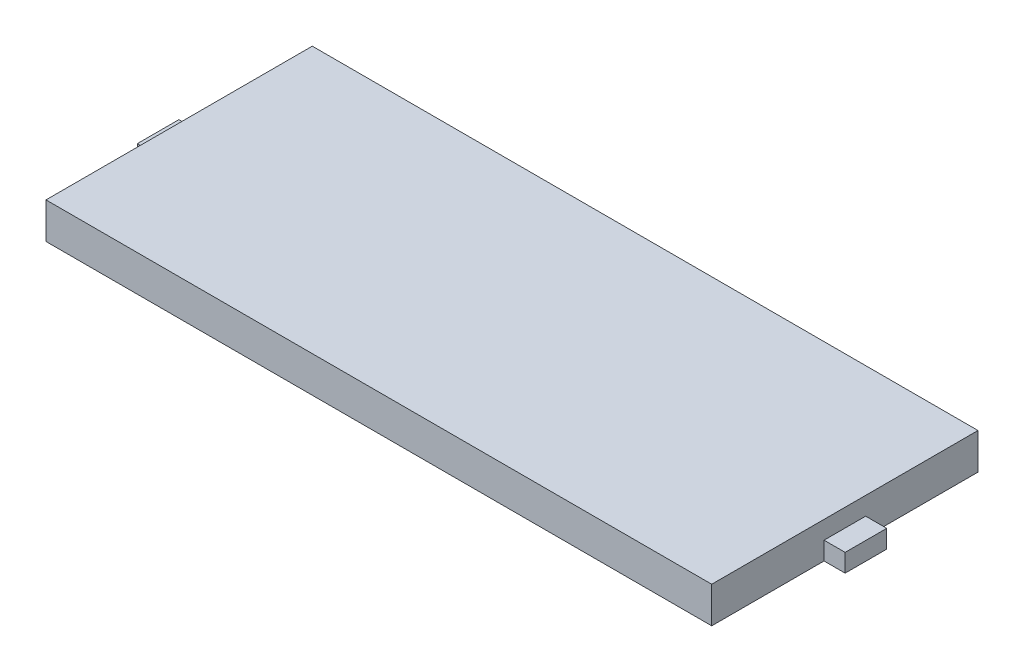
from build123d import *

# Parameters (mm, degrees)
SKETCH1_W           = 12
SKETCH1_H           = 4.8
BOSS_EXTRUDE1_DEPTH = 0.65
SKETCH2_W           = 5.76
SKETCH2_H           = 0.75
BOSS_EXTRUDE2_DEPTH = 0.325
SKETCH2_2_W         = 5.76
SKETCH2_2_H         = 0.75
CUT_EXTRUDE1_DEPTH  = 0.325


with BuildPart() as part:
    # Sketch1 → Boss-Extrude1 (new body)
    with BuildSketch(Plane(origin=(0, 0, 0), x_dir=(1, 0, 0), z_dir=(0, 1, 0))):
        Rectangle(SKETCH1_W, SKETCH1_H)
    extrude(amount=BOSS_EXTRUDE1_DEPTH)

    # Sketch2<2> → Cut-Extrude1 (cut)
    with BuildSketch(Plane(origin=(0, 0, 0), x_dir=(-1, 0, 0), z_dir=(0, 1, 0))):
        with Locations((3.5, 0)):
            Rectangle(SKETCH2_2_W, SKETCH2_2_H)
    cut_extrude1 = extrude(amount=CUT_EXTRUDE1_DEPTH, mode=Mode.SUBTRACT)

    # Mirror2: Cut-Extrude1 across plane
    add(cut_extrude1.mirror(Plane(origin=(0, 0, 0), x_dir=(0, 0, 1), z_dir=(1, 0, 0))), mode=Mode.SUBTRACT)


with BuildPart() as body_2:
    # Sketch2 → Boss-Extrude2 (new body)
    with BuildSketch(Plane(origin=(0, 0, 0), x_dir=(-1, 0, 0), z_dir=(0, 1, 0))):
        with Locations((3.5, 0)):
            Rectangle(SKETCH2_W, SKETCH2_H)
    extrude(amount=BOSS_EXTRUDE2_DEPTH)


with BuildPart() as body_3:
    # Mirror1: mirrored copy
    add(body_2.part.mirror(Plane(origin=(0, 0, 0), x_dir=(0, 0, 1), z_dir=(1, 0, 0))))


solid = Compound([part.part, body_2.part, body_3.part])
